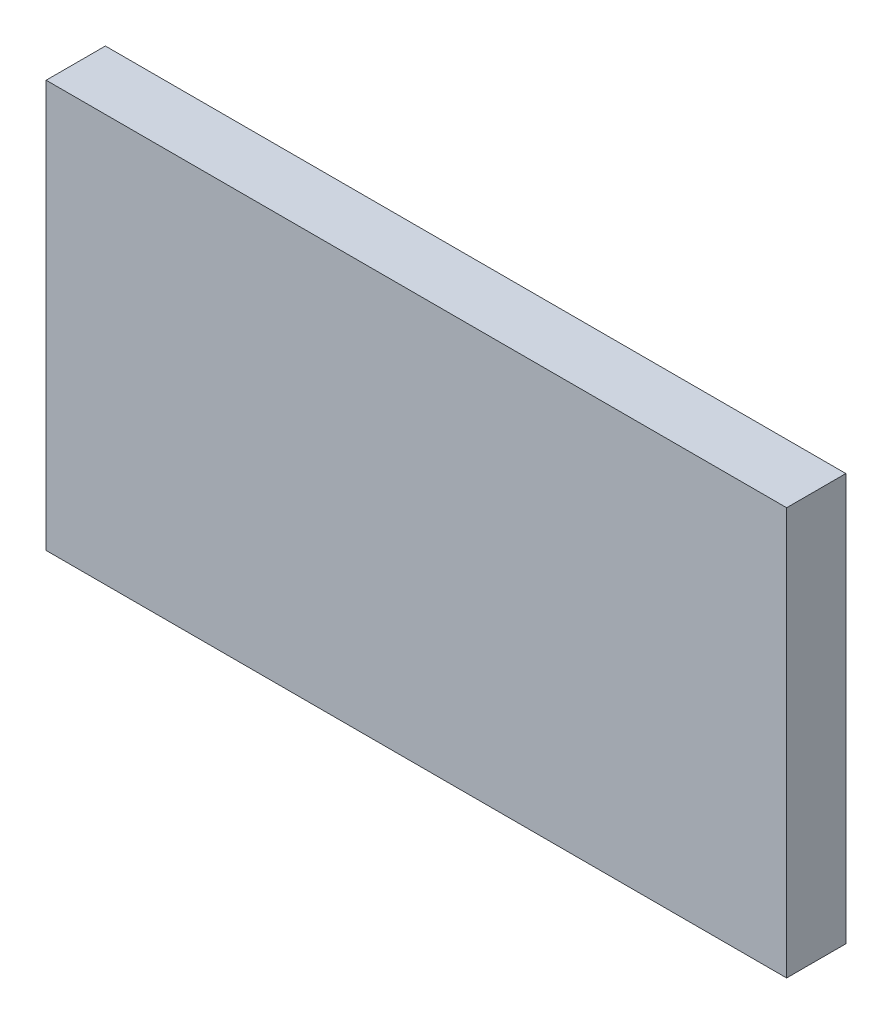
from build123d import *

# Parameters (mm, degrees)
SKETCH2_W           = 100
SKETCH2_H           = 55
BOSS_EXTRUDE1_DEPTH = 8


with BuildPart() as part:
    # Sketch2 → Boss-Extrude1 (new body)
    with BuildSketch(Plane.XY):
        Rectangle(SKETCH2_W, SKETCH2_H)
    extrude(amount=BOSS_EXTRUDE1_DEPTH)


solid = part.part
